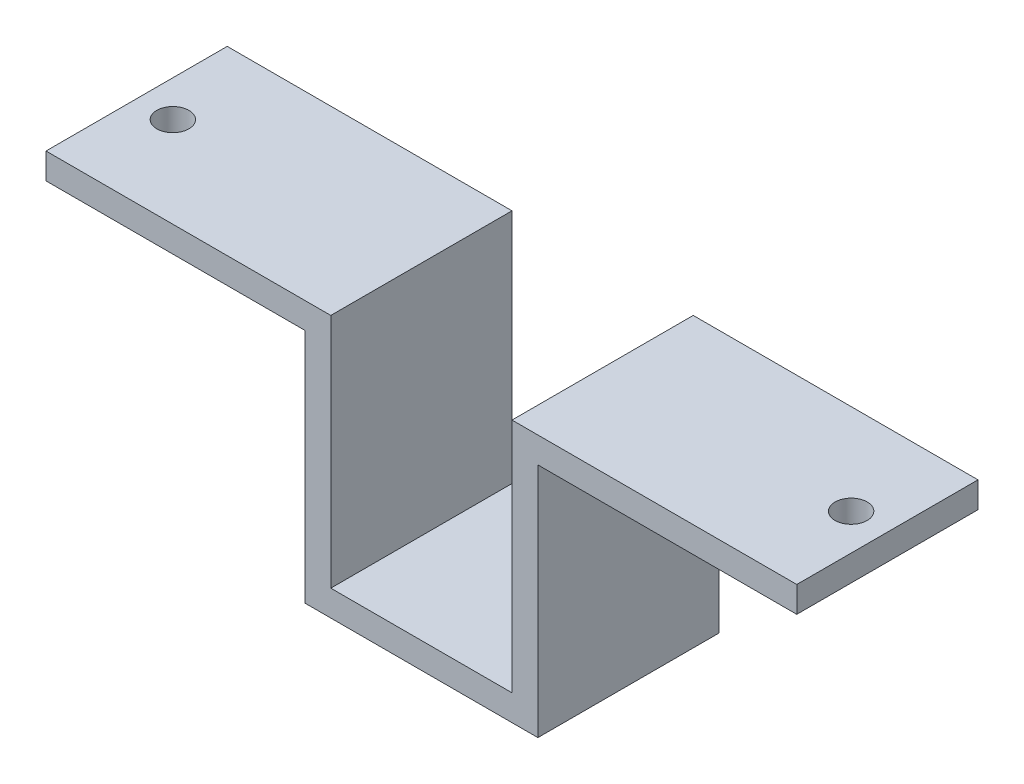
from build123d import *

# Parameters (mm, degrees)
BOSS_EXTRUDE1_DEPTH = 44.45
SKETCH2_R           = 3.937
CUT_EXTRUDE1_DEPTH  = 118.517447401


with BuildPart() as part:
    # Sketch1 → Boss-Extrude1 (new body)
    with BuildSketch(Plane.XY):
        Polygon((-22.225, 0), (22.225, 0), (22.225, 57.9374), (28.575, 57.9374), (92.075, 57.9374), (92.075, 51.5874), (28.575, 51.5874), (28.575, -6.35), (-28.575, -6.35), (-28.575, 51.5874), (-92.075, 51.5874), (-92.075, 57.9374), (-28.575, 57.9374), (-22.225, 57.9374), align=None)
    extrude(amount=BOSS_EXTRUDE1_DEPTH)

    # Sketch2 → Cut-Extrude1 (cut, through all)
    with BuildSketch(Plane.XZ.offset(-51.5874)):
        with Locations((83.185, 22.225)):
            Circle(SKETCH2_R)
        with Locations((-83.185, 22.225)):
            Circle(SKETCH2_R)
    extrude(amount=-CUT_EXTRUDE1_DEPTH, mode=Mode.SUBTRACT)


solid = part.part
